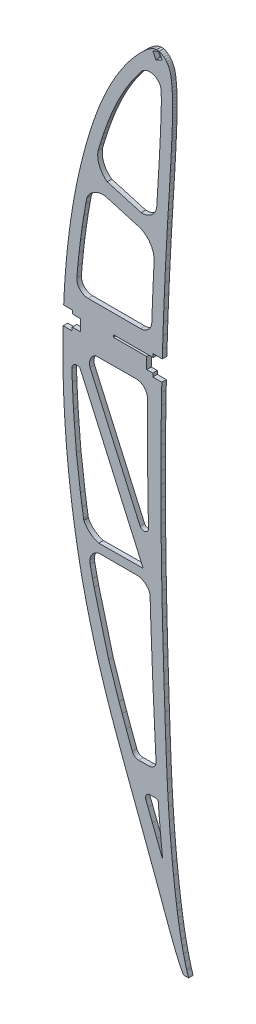
from build123d import *

# Parameters (mm, degrees)
EXTRUDE_1_DEPTH = 2


with BuildPart() as part:
    # Model → 凸台-拉伸1 (new body)
    with BuildSketch(Plane.XY):
        Polygon((912.315528705, 187.049113644), (913.838377566, 184.290519254), (916.038377566, 184.290519254), (915.283233679, 186.753248938), (915.110888999, 187.325459363), (914.444799421, 189.834793274), (913.824273488, 192.35512511), (913.265347984, 194.840110277), (912.752073362, 197.334095274), (912.280409811, 199.83790467), (911.844493899, 202.348279606), (911.440285814, 204.866044652), (911.060879456, 207.388896374), (910.702365873, 209.914662201), (910.039727702, 214.93553709), (909.435946136, 219.96098362), (908.888067652, 224.989871883), (908.395005962, 230.024156358), (907.951809445, 235.062619898), (907.555480954, 240.105131646), (907.204977824, 245.15264703), (906.895741007, 250.194957472), (906.622469926, 255.238838212), (906.381212007, 260.283115724), (906.163931245, 265.328440101), (905.966631448, 270.374636866), (905.782232039, 275.423398779), (905.606780445, 280.473552315), (905.435325043, 285.523880329), (905.267909454, 290.573383772), (905.105576345, 295.621107215), (904.949237525, 300.669092375), (904.80093471, 305.716427442), (904.659537994, 310.76606594), (904.529087189, 315.817183301), (904.408583247, 320.869735903), (904.299112454, 325.921769271), (904.200718431, 330.972284355), (904.114312987, 336.023322872), (904.038897072, 341.074841202), (903.975469737, 346.126882965), (903.923943742, 351.181446257), (903.885318134, 356.238574697), (903.858724725, 361.295227522), (903.846248849, 366.349493873), (903.846760599, 371.404327277), (903.863257122, 376.459858591), (903.893740319, 381.516000576), (903.941207336, 386.572884091), (904.003398361, 391.636416186), (904.083703111, 396.697736285), (904.179080823, 401.757712579), (904.245315117, 405.739131963), (900.263193532, 405.739131963), (900.263193532, 407.239025413), (897.603288298, 407.239025413), (897.603288298, 412.239025413), (882.949388298, 412.239025413), (882.949388298, 413.239025413), (900.438110318, 413.239025413), (900.438110318, 414.738302892), (904.469945299, 414.738302892), (904.585297681, 418.583596462), (904.749291792, 423.722641017), (904.930963435, 428.869464058), (905.128750708, 434.013987864), (905.342609991, 439.157211484), (905.571498617, 444.300090347), (905.816459254, 449.441669023), (906.075406565, 454.583858371), (906.348340551, 459.726658391), (906.490171452, 462.301295452), (906.635043116, 464.875064322), (906.782955545, 467.447965003), (906.932909689, 470.019953875), (907.085817358, 472.593072653), (907.240723124, 475.166278669), (907.396627938, 477.739528305), (907.554530849, 480.31286518), (907.711478331, 482.885159387), (907.866384097, 485.458365403), (908.018336337, 488.030441514), (908.164250669, 490.603254956), (908.304127093, 493.17680573), (908.434924843, 495.751962026), (908.49589343, 497.037845314), (908.55586297, 498.323684983), (908.612835364, 499.609393794), (908.667809662, 500.895015366), (908.720785864, 502.180549699), (908.771763969, 503.465996794), (908.820700358, 504.752355698), (908.86772589, 506.036629266), (908.911797896, 507.319772929), (908.950831042, 508.603697542), (908.981871802, 509.887273201), (909.004832937, 511.172498001), (909.015805494, 512.457199368), (909.013659566, 513.744330828), (908.996615153, 515.028809901), (908.96354235, 516.313590111), (908.913485726, 517.597628792), (908.844490806, 518.879839657), (908.75560216, 520.159180037), (908.64586436, 521.434607266), (908.513279308, 522.706034103), (908.428186462, 523.416999087), (908.326153415, 524.126223492), (908.200317688, 524.83040484), (908.041644228, 525.530149602), (907.841141601, 526.225065206), (907.591903708, 526.912848219), (907.282941019, 527.593018828), (906.859681665, 528.346273445), (906.361803228, 529.066241543), (905.800124958, 529.734377398), (905.184641535, 530.328095477), (904.527302117, 530.82589653), (903.837926905, 531.209191217), (903.12555515, 531.454351336), (901.963985838, 531.533759974), (900.787232051, 531.273182682), (899.610615875, 530.734346553), (898.44737406, 529.980889534), (897.31378412, 529.075581382), (896.223039187, 528.083059095), (895.189462297, 527.065006144), (894.44777941, 526.307933825), (893.743406064, 525.567504767), (893.069610639, 524.837419344), (892.4225278, 524.114505933), (891.795513164, 523.390466814), (891.184701396, 522.662130364), (890.584359924, 521.923240578), (889.620322192, 520.688014181), (888.671928672, 519.415434623), (887.740959364, 518.110584383), (886.829237886, 516.777546895), (885.939543285, 515.421448256), (885.072612895, 514.048326376), (884.230270333, 512.662264686), (883.473829128, 511.372041177), (882.740714987, 510.074828528), (882.028929813, 508.770539501), (881.337518179, 507.458131427), (880.666523702, 506.136605259), (880.014903717, 504.806916425), (879.381746413, 503.46702321), (878.795274263, 502.181217853), (878.22517946, 500.887118971), (877.669420286, 499.585638375), (877.127953124, 498.277775113), (876.600777972, 496.963529185), (876.086895783, 495.642856972), (875.585220269, 494.31771295), (874.65226564, 491.751575646), (873.760926279, 489.172241014), (872.911158567, 486.580708102), (872.099965358, 483.976846052), (871.324305889, 481.361523053), (870.583137492, 478.735694534), (869.874374832, 476.101271354), (869.211991991, 473.527929369), (868.578930504, 470.947859961), (867.973148655, 468.361974938), (867.395645491, 465.770317921), (866.844466536, 463.171802621), (866.320567219, 460.567471708), (865.822948491, 457.957281562), (864.924558303, 452.834218311), (864.122905513, 447.696360605), (863.414949356, 442.544576635), (862.796606401, 437.380690018), (862.263836836, 432.205525326), (861.813512658, 427.021948845), (861.441550435, 421.831784194), (861.14819929, 416.698102269), (861.013356307, 413.567513952), (864.948807063, 413.567513952), (864.948807063, 412.068903464), (867.268352516, 412.068903464), (868.268352516, 412.068903464), (868.358307063, 412.068903464), (868.358307063, 407.068903464), (864.775564072, 407.068903464), (864.775564072, 405.568924457), (860.767628164, 405.568924457), (860.674897498, 399.733090514), (860.662658885, 394.671739388), (860.714446596, 389.611181807), (860.832345968, 384.549506913), (861.011880994, 379.497529758), (861.25335701, 374.448257005), (861.557642206, 369.404729418), (861.921826675, 364.364818042), (862.346909467, 359.328566498), (862.831847913, 354.296930213), (863.375642966, 349.269865568), (863.982556731, 344.218531024), (864.65114977, 339.17589517), (865.382377512, 334.143000676), (866.17919348, 329.120977447), (867.042596725, 324.109869103), (867.976539819, 319.110849169), (868.983020858, 314.124004885), (870.080558737, 309.069067635), (871.253326371, 304.033430229), (872.499412901, 299.015007334), (873.817732042, 294.015753425), (875.208283792, 289.035668503), (876.669026437, 284.075664378), (878.199959975, 279.135741048), (879.832769604, 274.109179031), (881.526691454, 269.104303331), (883.271822282, 264.11867966), (885.0603878, 259.14696382), (886.880443046, 254.187633331), (888.724257354, 249.234344949), (890.581883859, 244.285663431), (892.453544856, 239.313571807), (894.326117662, 234.3435219), (896.196692372, 229.373384753), (898.06327089, 224.403073129), (899.92103245, 219.428372738), (901.769977055, 214.449283579), (903.606195748, 209.463633079), (904.518962998, 206.967071254), (905.432642057, 204.472551144), (906.349274641, 201.979160941), (907.274767801, 199.489160457), (908.213074111, 197.003723218), (909.168102523, 194.525021797), (910.142850184, 192.053187054), (911.217228425, 189.571314816), align=None)
        with BuildLine():
            Line((885.402450296, 274.456131197), (880.835641884, 288.133439589))
            Line((880.835641884, 288.133439589), (874.410642305, 312.530176817))
            Line((874.410642305, 312.530176817), (873.725777039, 315.533531172))
            Line((873.725777039, 315.533531172), (872.666093666, 320.51477266))
            Line((872.666093666, 320.51477266), (872.587243257, 322.015408196))
            ThreePointArc((872.587243257, 322.015408196), (873.778471383, 324.961757139), (876.484308709, 326.628622732))
            Line((876.484308709, 326.628622732), (893.113301322, 326.628622732))
            Line((893.113301322, 326.628622732), (893.160780779, 326.628622732))
            ThreePointArc((893.160780779, 326.628622732), (896.807615304, 325.436162454), (899.069063243, 322.336611393))
            Line((899.069063243, 322.336611393), (899.245041344, 316.198154156))
            Line((899.245041344, 316.198154156), (899.431969895, 311.060541036))
            Line((899.431969895, 311.060541036), (900.14388129, 292.487151259))
            Line((900.14388129, 292.487151259), (901.070359356, 272.578353625))
            Line((901.070359356, 272.578353625), (901.190811179, 270.011499191))
            Line((901.190811179, 270.011499191), (901.704333252, 259.630046568))
            ThreePointArc((901.704333252, 259.630046568), (900.891886751, 257.424983571), (898.739412112, 256.48199626))
            Line((898.739412112, 256.48199626), (894.083998534, 256.433243101))
            ThreePointArc((894.083998534, 256.433243101), (892.352852851, 256.961051748), (891.240304634, 258.388526375))
            Line((891.240304634, 258.388526375), (888.576636982, 265.559996742))
            Line((888.576636982, 265.559996742), (886.767161342, 270.55958795))
            Line((886.767161342, 270.55958795), (885.402450296, 274.456131197))
        make_face(mode=Mode.SUBTRACT)
        with BuildLine():
            ThreePointArc((901.678552566, 245.738499127), (902.366436841, 245.474157328), (902.686444566, 244.81033776))
            Line((902.686444566, 244.81033776), (902.724151103, 244.28641368))
            Line((902.724151103, 244.28641368), (902.725356272, 244.270549655))
            Line((902.725356272, 244.270549655), (903.137650419, 239.114959477))
            Line((903.137650419, 239.114959477), (903.597082321, 233.95296533))
            Line((903.597082321, 233.95296533), (904.105911327, 228.794728222))
            Line((904.105911327, 228.794728222), (904.654066325, 223.742264584))
            Line((904.654066325, 223.742264584), (903.985649745, 225.475588251))
            Line((903.985649745, 225.475588251), (902.036514015, 230.506305567))
            Line((902.036514015, 230.506305567), (900.082171182, 235.536440846))
            Line((900.082171182, 235.536440846), (898.128209058, 240.562965808))
            Line((898.128209058, 240.562965808), (897.186568608, 242.98655793))
            ThreePointArc((897.186568608, 242.98655793), (897.394362852, 244.831676266), (899.029859728, 245.710761067))
            Line((899.029859728, 245.710761067), (901.678552566, 245.738499127))
        make_face(mode=Mode.SUBTRACT)
        with BuildLine():
            Line((869.888864678, 335.828688582), (869.761525841, 336.494470572))
            Line((869.761525841, 336.494470572), (869.123081117, 340.585921035))
            Line((869.123081117, 340.585921035), (868.40026868, 345.637626217))
            Line((868.40026868, 345.637626217), (866.603054067, 360.016978343))
            Line((866.603054067, 360.016978343), (865.701315288, 370.888194046))
            Line((865.701315288, 370.888194046), (865.343316854, 375.945326994))
            Line((865.343316854, 375.945326994), (865.156961082, 379.133159167))
            Line((865.156961082, 379.133159167), (865.047427556, 381.006857489))
            Line((865.047427556, 381.006857489), (864.814616167, 386.072892012))
            Line((864.814616167, 386.072892012), (864.643663748, 391.147351338))
            ThreePointArc((864.643663748, 391.147351338), (865.784683059, 393.302053897), (868.216426043, 393.12515208))
            Line((868.216426043, 393.12515208), (896.051832362, 330.60580587))
            Line((896.051832362, 330.60580587), (876.484308709, 330.45414373))
            ThreePointArc((876.484308709, 330.45414373), (872.611575222, 332.435783199), (869.888864678, 335.828688582))
        make_face(mode=Mode.SUBTRACT)
        with BuildLine():
            ThreePointArc((892.898514168, 401.407375341), (896.45616789, 399.940641376), (897.918258991, 396.381077058))
            Line((897.918258991, 396.381077058), (897.902375941, 393.365831985))
            Line((897.902375941, 393.365831985), (897.892351981, 388.208331722))
            Line((897.892351981, 388.208331722), (897.965530895, 372.077201646))
            Line((897.965530895, 372.077201646), (898.358916635, 347.03359632))
            ThreePointArc((898.358916635, 347.03359632), (896.90884862, 345.059867878), (894.658816032, 346.027160263))
            Line((894.658816032, 346.027160263), (872.607241126, 395.555808423))
            ThreePointArc((872.607241126, 395.555808423), (872.787840488, 398.914618374), (875.144476704, 401.314719655))
            Line((875.144476704, 401.314719655), (892.898514168, 401.407375341))
        make_face(mode=Mode.SUBTRACT)
        with BuildLine():
            Line((869.070153317, 446.970541584), (869.473487549, 449.555543363))
            Line((869.473487549, 449.555543363), (869.857533048, 452.016922097))
            Line((869.857533048, 452.016922097), (870.741412402, 457.057237425))
            Line((870.741412402, 457.057237425), (871.2273647, 459.606232933))
            ThreePointArc((871.2273647, 459.606232933), (874.496725449, 463.337705033), (879.362680455, 464.304703283))
            Line((879.362680455, 464.304703283), (894.692098731, 459.875313057))
            ThreePointArc((894.692098731, 459.875313057), (899.42421169, 455.78378711), (900.822446426, 449.686376409))
            Line((900.822446426, 449.686376409), (900.576791188, 444.53021846))
            Line((900.576791188, 444.53021846), (900.347230049, 439.372228963))
            Line((900.347230049, 439.372228963), (900.132742469, 434.213895058))
            Line((900.132742469, 434.213895058), (899.829188809, 426.318346435))
            ThreePointArc((899.829188809, 426.318346435), (898.299835074, 422.907627832), (894.832879988, 421.510435408))
            Line((894.832879988, 421.510435408), (871.806740388, 421.510435408))
            ThreePointArc((871.806740388, 421.510435408), (868.121382205, 423.131362301), (866.825502498, 426.943181384))
            Line((866.825502498, 426.943181384), (867.241628187, 431.733107033))
            Line((867.241628187, 431.733107033), (867.766072294, 436.827400707))
            Line((867.766072294, 436.827400707), (868.374315437, 441.906942094))
            Line((868.374315437, 441.906942094), (869.070153317, 446.970541584))
        make_face(mode=Mode.SUBTRACT)
        with BuildLine():
            ThreePointArc((880.201899523, 470.22796314), (876.767083166, 474.515306473), (876.127316271, 479.97149329))
            Line((876.127316271, 479.97149329), (876.883852644, 482.522338156))
            Line((876.883852644, 482.522338156), (877.673826952, 485.058089318))
            Line((877.673826952, 485.058089318), (878.4996671, 487.576650441))
            Line((878.4996671, 487.576650441), (879.364996652, 490.080718566))
            Line((879.364996652, 490.080718566), (880.27302091, 492.578283665))
            Line((880.27302091, 492.578283665), (880.754892447, 493.851116739))
            Line((880.754892447, 493.851116739), (881.251035511, 495.126199574))
            Line((881.251035511, 495.126199574), (881.758251902, 496.390688377))
            Line((881.758251902, 496.390688377), (882.278578496, 497.647488575))
            Line((882.278578496, 497.647488575), (882.812316125, 498.897398967))
            Line((882.812316125, 498.897398967), (883.35787438, 500.135800587))
            Line((883.35787438, 500.135800587), (883.91686639, 501.36135737))
            Line((883.91686639, 501.36135737), (884.520400301, 502.638561294))
            Line((884.520400301, 502.638561294), (885.140797589, 503.904537421))
            Line((885.140797589, 503.904537421), (885.77872159, 505.160931163))
            Line((885.77872159, 505.160931163), (886.43548472, 506.407570923))
            Line((886.43548472, 506.407570923), (887.111917543, 507.647079614))
            Line((887.111917543, 507.647079614), (887.807245798, 508.87743183))
            Line((887.807245798, 508.87743183), (888.523626096, 510.099325475))
            Line((888.523626096, 510.099325475), (889.323274788, 511.415135061))
            Line((889.323274788, 511.415135061), (890.144091113, 512.715217361))
            Line((890.144091113, 512.715217361), (890.983440841, 513.994578866))
            Line((890.983440841, 513.994578866), (891.840008422, 515.246975265))
            Line((891.840008422, 515.246975265), (892.712042015, 516.469220975))
            Line((892.712042015, 516.469220975), (893.596194264, 517.655599894))
            Line((893.596194264, 517.655599894), (894.4958505, 518.808333957))
            Line((894.4958505, 518.808333957), (894.645355288, 518.992341835))
            ThreePointArc((894.645355288, 518.992341835), (900.564103603, 521.303260038), (903.971495859, 515.940275555))
            Line((903.971495859, 515.940275555), (903.997468861, 514.931301576))
            Line((903.997468861, 514.931301576), (904.013714871, 513.706990669))
            Line((904.013714871, 513.706990669), (904.015769896, 512.474383348))
            Line((904.015769896, 512.474383348), (904.005214355, 511.238507536))
            Line((904.005214355, 511.238507536), (903.982951544, 509.992370706))
            Line((903.982951544, 509.992370706), (903.952668009, 508.740107265))
            Line((903.952668009, 508.740107265), (903.91440633, 507.481558681))
            Line((903.91440633, 507.481558681), (903.870867076, 506.213925943))
            Line((903.870867076, 506.213925943), (903.824179181, 504.938873258))
            Line((903.824179181, 504.938873258), (903.775531422, 503.660101405))
            Line((903.775531422, 503.660101405), (903.724866561, 502.382552978))
            Line((903.724866561, 502.382552978), (903.672209229, 501.104756401))
            Line((903.672209229, 501.104756401), (903.617565695, 499.826870026))
            Line((903.617565695, 499.826870026), (903.561021579, 498.550826282))
            Line((903.561021579, 498.550826282), (903.501322433, 497.270784247))
            Line((903.501322433, 497.270784247), (903.440934594, 495.997181081))
            Line((903.440934594, 495.997181081), (903.311014393, 493.439302048))
            Line((903.311014393, 493.439302048), (903.171939109, 490.880491233))
            Line((903.171939109, 490.880491233), (903.02669165, 488.319436323))
            Line((903.02669165, 488.319436323), (902.875251566, 485.756029418))
            Line((902.875251566, 485.756029418), (902.720513736, 483.185613058))
            Line((902.720513736, 483.185613058), (902.563811895, 480.617371861))
            Line((902.563811895, 480.617371861), (902.406014417, 478.045758091))
            Line((902.406014417, 478.045758091), (902.24987482, 475.468657912))
            Line((902.24987482, 475.468657912), (902.094852763, 472.893526323))
            Line((902.094852763, 472.893526323), (902.002847481, 471.365190857))
            ThreePointArc((902.002847481, 471.365190857), (899.643354999, 467.330110315), (895.189072876, 465.912912193))
            Line((895.189072876, 465.912912193), (880.201899523, 470.22796314))
        make_face(mode=Mode.SUBTRACT)
        Polygon((900.381374001, 530.173904209), (903.107309195, 531.427000503), (904.35940644, 528.70102169), (901.633427627, 527.448924445), align=None, mode=Mode.SUBTRACT)
    extrude(amount=EXTRUDE_1_DEPTH)


solid = part.part
